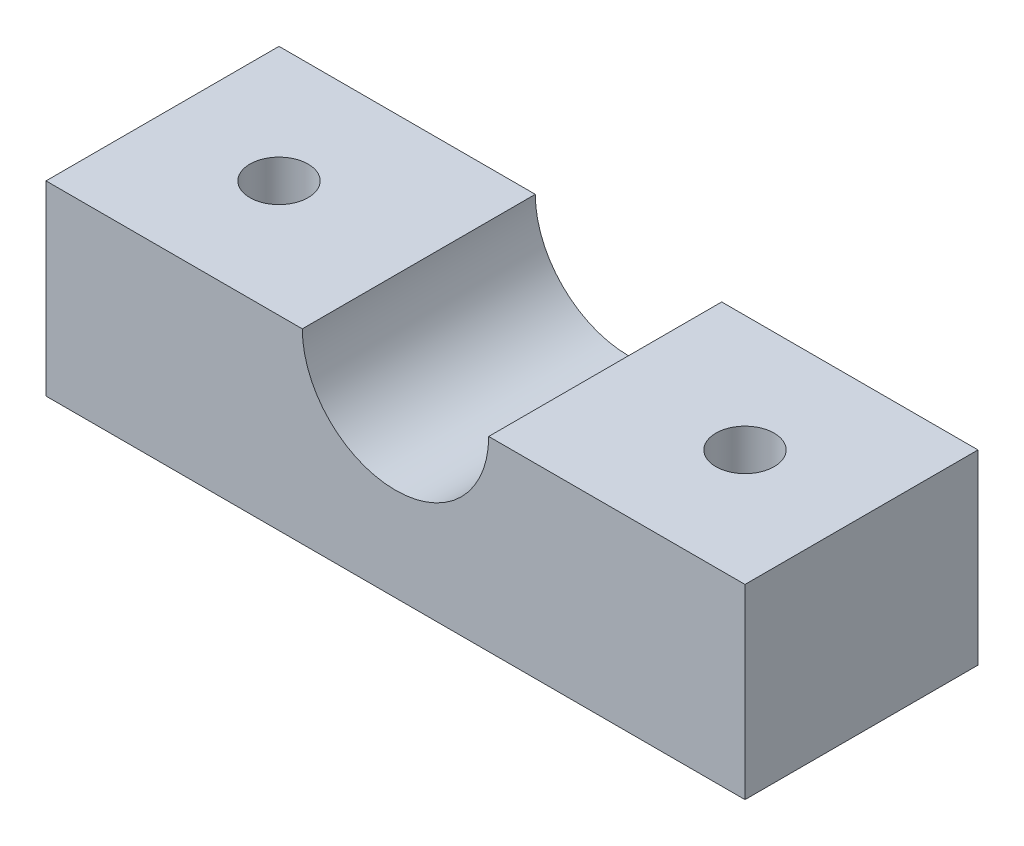
from build123d import *

# Parameters (mm, degrees)
AUFSATZ_LINEAR_AUSTRAGEN1_DEPTH = 10
M3_GEWINDEBOHRUNG1_D            = 2.5


with BuildPart() as part:
    # Skizze1 → Aufsatz-Linear austragen1 (new body)
    with BuildSketch(Plane.XY):
        with BuildLine():
            Line((19, 8), (30, 8))
            Line((30, 8), (30, 0))
            Line((30, 0), (0, 0))
            Line((0, 0), (0, 8))
            Line((0, 8), (11, 8))
            ThreePointArc((11, 8), (15, 4), (19, 8))
        make_face()
    extrude(amount=AUFSATZ_LINEAR_AUSTRAGEN1_DEPTH)

    # M3 Gewindebohrung1 (through all)
    with Locations(Plane(origin=(0, 0, 0), x_dir=(-1, 0, 0), z_dir=(0, -1, 0))):
        with Locations((-5, -5), (-25, -5)):
            Hole(M3_GEWINDEBOHRUNG1_D / 2)


solid = part.part
